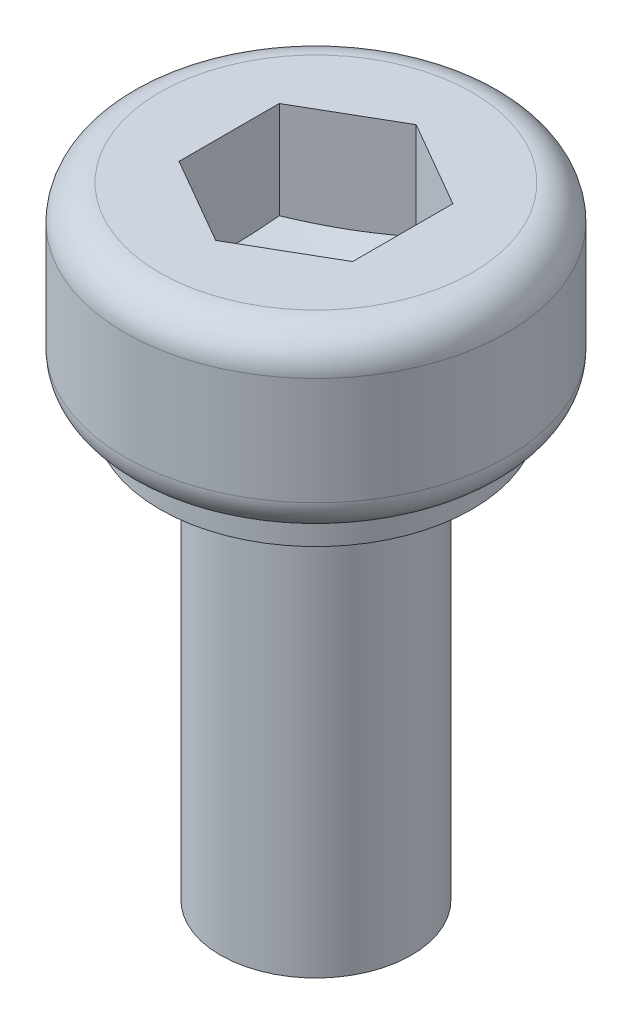
from build123d import *

# Parameters (mm, degrees)
BOSS_EXTRUDE1_DEPTH = 2


with BuildPart() as part:
    # Sketch1 → Revolve1 (revolve)
    with BuildSketch(Plane.XY):
        with BuildLine():
            Line((0, 4.475), (2.25, 4.475))
            ThreePointArc((2.25, 4.475), (2.603553391, 4.328553391), (2.75, 3.975))
            Line((2.75, 3.975), (2.75, 2.425))
            ThreePointArc((2.75, 2.425), (2.603553391, 2.071446609), (2.25, 1.925))
            Line((2.25, 1.925), (2.25, 1.525))
            Line((2.25, 1.525), (1.375, 1.525))
            Line((1.375, 1.525), (1.375, -4.475))
            Line((1.375, -4.475), (0, -4.475))
            Line((0, -4.475), (0, 4.475))
        make_face()
    revolve(axis=Axis((0, 4.094224924, 0), (0, -1, 0)))


with BuildPart() as body_2:
    # Sketch2 → Boss-Extrude1 (new body)
    with BuildSketch(Plane(origin=(0, 4.475, 0), x_dir=(1, 0, 0), z_dir=(0, 1, 0))):
        Polygon((0, 1.443375673), (-1.25, 0.721687836), (-1.25, -0.721687836), (0, -1.443375673), (1.25, -0.721687836), (1.25, 0.721687836), align=None)
    extrude(amount=-BOSS_EXTRUDE1_DEPTH)

    # Sketch3 → Cut-Revolve1 (revolve, cut)
    with BuildSketch(Plane(origin=(0, 0, 0), x_dir=(0, 0, -1), z_dir=(1, 0, 0))):
        Polygon((0, 2.875), (0.4, 2.875), (1.443375673, 3.075), (1.443375673, 2.475), (0, 2.475), align=None)
    revolve(axis=Axis((0, 2.475, 0), (0, 1, 0)), mode=Mode.SUBTRACT)


with BuildPart() as part_1:
    add(part.part)

    # Combine1: cut body 2
    add(body_2.part, mode=Mode.SUBTRACT)


solid = part_1.part
